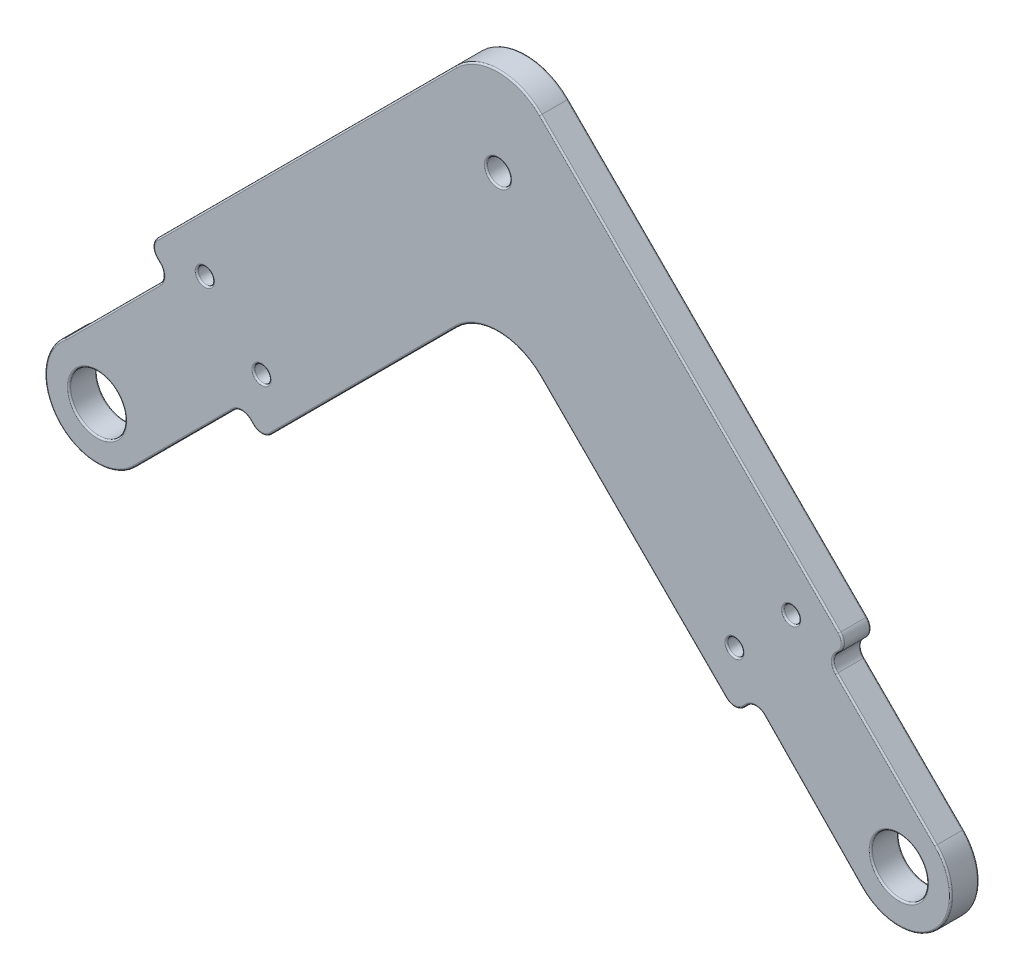
from build123d import *

# Parameters (mm, degrees)
SKETCH5_R           = 1
SKETCH5_R_2         = 1.5
SKETCH5_R_3         = 3.5
BOSS_EXTRUDE1_DEPTH = 3.5
FILLET1_R           = 7.5
FILLET2_R           = 1.5
FILLET3_R           = 0.2


with BuildPart() as part:
    # Sketch5 → Boss-Extrude1 (new body)
    # profile 1 of 4: a face of its own
    with BuildSketch(Plane.XY):
        with BuildLine():
            Line((-95.382736856, -4.575027984), (-81.968825593, 8.838883278))
            Line((-81.968825593, 8.838883278), (-91.1209602, 17.991017886))
            Line((-91.1209602, 17.991017886), (-103.949388812, 5.162589274))
            ThreePointArc((-103.949388812, 5.162589274), (-97.120853189, 5.827564984), (-93.5, 0))
            ThreePointArc((-93.5, 0), (-93.989084494, -2.473639986), (-95.382736856, -4.575027984))
        make_face()
    # profile 2 of 4: a face of its own
    with BuildSketch(Plane.XY):
        Polygon((-91.1209602, 17.991017886), (-81.968825593, 8.838883278), (-79.493903346, 6.363961031), (-50, 35.857864376), (-20.506096654, 6.363961031), (-17.850909276, 9.019148409), (-8.838834765, 18.03122292), (-6.363961031, 20.506096654), (-50, 64.142135624), (-93.636038969, 20.506096654), align=None)
        with Locations((-79.493903346, 13.435028843)):
            Circle(SKETCH5_R, mode=Mode.SUBTRACT)
        with Locations((-86.564971157, 20.506096654)):
            Circle(SKETCH5_R, mode=Mode.SUBTRACT)
        with Locations((-20.506096654, 13.435028843)):
            Circle(SKETCH5_R, mode=Mode.SUBTRACT)
        with Locations((-13.435028843, 20.506096654)):
            Circle(SKETCH5_R, mode=Mode.SUBTRACT)
        with Locations((-50, 50)):
            Circle(SKETCH5_R_2, mode=Mode.SUBTRACT)
    # profile 3 of 4: a face of its own
    with BuildSketch(Plane.XY):
        with BuildLine():
            Line((-95.424972016, -4.617263144), (-95.382736856, -4.575027984))
            ThreePointArc((-95.382736856, -4.575027984), (-93.989084494, -2.473639986), (-93.5, 0))
            ThreePointArc((-93.5, 0), (-97.120853189, 5.827564984), (-103.949388812, 5.162589274))
            ThreePointArc((-103.949388812, 5.162589274), (-104.899921879, -4.270920928), (-95.424972016, -4.617263144))
        make_face()
        with Locations((-100, 0)):
            Circle(SKETCH5_R_3, mode=Mode.SUBTRACT)
    # profile 4 of 4: a face of its own
    with BuildSketch(Plane.XY):
        with BuildLine():
            Line((-8.838834765, 18.03122292), (-17.850909276, 9.019148409))
            Line((-17.850909276, 9.019148409), (-4.657601188, -4.533955357))
            ThreePointArc((-4.657601188, -4.533955357), (4.565177968, -4.627002282), (4.596194078, 4.596194078))
            Line((4.596194078, 4.596194078), (-8.838834765, 18.03122292))
        make_face()
        Circle(SKETCH5_R_3, mode=Mode.SUBTRACT)
    extrude(amount=BOSS_EXTRUDE1_DEPTH)

    # Fillet1
    fillet1_edges = [part.edges().sort_by_distance(p)[0] for p in [
        (-50, 35.857864376, 1.75),
        (-50, 64.142135624, 1.75),
    ]]
    fillet(fillet1_edges, radius=FILLET1_R)

    # Fillet2
    fillet2_edges = [part.edges().sort_by_distance(p)[0] for p in [
        (-17.850909276, 9.019148409, 1.75),
        (-20.506096654, 6.363961031, 1.75),
        (-79.493903346, 6.363961031, 1.75),
        (-81.968825593, 8.838883278, 1.75),
        (-91.1209602, 17.991017886, 1.75),
        (-93.636038969, 20.506096654, 1.75),
        (-6.363961031, 20.506096654, 1.75),
        (-8.838834765, 18.03122292, 1.75),
    ]]
    fillet(fillet2_edges, radius=FILLET2_R)

    # Fillet3
    fillet3_edges = [part.edges().sort_by_distance(p)[0] for p in [
        (-17.855184959, 8.383430059, 0),
        (-17.855184959, 8.383430059, 3.5),
        (-8.217514421, 18.03122292, 0),
        (-8.217514421, 18.03122292, 3.5),
        (-91.742280544, 17.991017886, 0),
        (-91.742280544, 17.991017886, 3.5),
        (-81.968825593, 8.217562935, 0),
        (-81.968825593, 8.217562935, 3.5),
        (-51.5, 50, 3.5),
        (-3.5, 0, 3.5),
        (-103.5, 0, 3.5),
        (-104.899921879, -4.270920928, 0),
        (-80.493903346, 13.435028843, 3.5),
        (4.565177968, -4.627002282, 0),
        (-21.506096654, 13.435028843, 0),
        (-14.435028843, 20.506096654, 0),
        (-87.564971157, 20.506096654, 0),
        (-80.493903346, 13.435028843, 0),
        (-87.564971157, 20.506096654, 3.5),
        (-103.5, 0, 0),
        (-3.5, 0, 0),
        (-51.5, 50, 0),
        (-14.435028843, 20.506096654, 3.5),
        (-95.424972016, -4.617263144, 1.75),
        (-103.949388812, 5.162589274, 1.75),
        (-21.506096654, 13.435028843, 3.5),
        (4.565177968, -4.627002282, 3.5),
        (-33.131727984, 18.98959236, 0),
        (-33.131727984, 18.98959236, 3.5),
        (-73.939339828, 40.202795796, 0),
        (-73.939339828, 40.202795796, 3.5),
        (-50, 61.035533906, 0),
        (-50, 61.035533906, 3.5),
        (-50, 32.751262658, 0),
        (-50, 32.751262658, 3.5),
        (-19.185685006, 7.684372679, 0),
        (-19.185685006, 7.684372679, 3.5),
        (-26.060660172, 40.202795796, 0),
        (-7.601397898, 19.268659787, 0),
        (-1.590990258, 10.783378413, 0),
        (-10.724021751, 1.697903009, 0),
        (-66.868272016, 18.98959236, 0),
        (-80.731364469, 7.601422154, 0),
        (-89.22722889, 1.580479981, 0),
        (-98.065504592, 11.046473494, 0),
        (-92.378499585, 19.24855727, 0),
        (-79.493903346, 6.985281374, 0),
        (-93.014718626, 20.506096654, 0),
        (-6.985281374, 20.506096654, 0),
        (-20.506096654, 6.985281374, 0),
        (-104.899921879, -4.270920928, 3.5),
        (-26.060660172, 40.202795796, 3.5),
        (-92.378499585, 19.24855727, 3.5),
        (-98.065504592, 11.046473494, 3.5),
        (-89.22722889, 1.580479981, 3.5),
        (-80.731364469, 7.601422154, 3.5),
        (-66.868272016, 18.98959236, 3.5),
        (-10.724021751, 1.697903009, 3.5),
        (-1.590990258, 10.783378413, 3.5),
        (-7.601397898, 19.268659787, 3.5),
        (-79.493903346, 6.985281374, 3.5),
        (-93.014718626, 20.506096654, 3.5),
        (-6.985281374, 20.506096654, 3.5),
        (-20.506096654, 6.985281374, 3.5),
    ]]
    fillet(fillet3_edges, radius=FILLET3_R)


solid = part.part
